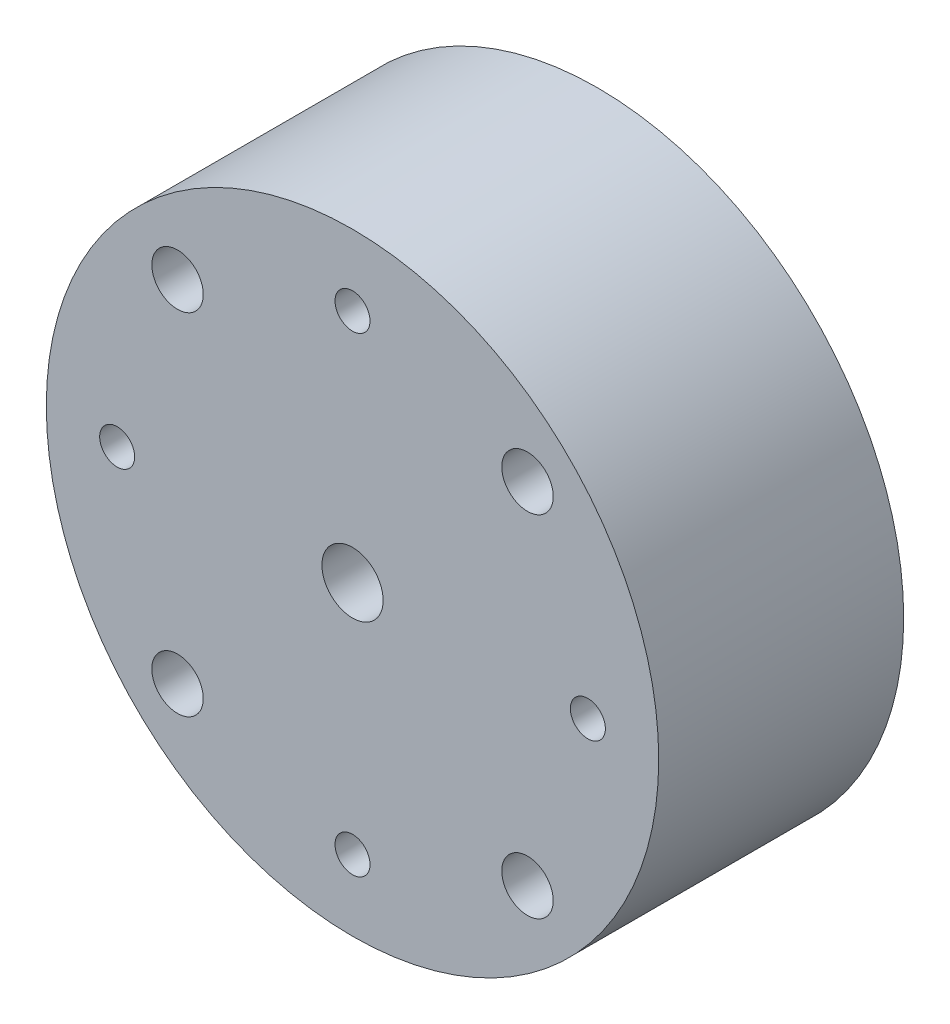
from build123d import *

# Parameters (mm, degrees)
SKETCH1_R           = 17.5
SKETCH1_R_2         = 1.75
BOSS_EXTRUDE1_DEPTH = 14
SKETCH2_R           = 1
CUT_EXTRUDE1_DEPTH  = 29.434134416
CIRPATTERN1_COUNT   = 4
SKETCH3_R           = 1.47
CUT_EXTRUDE2_DEPTH  = 29.434134416
CIRPATTERN2_COUNT   = 4


with BuildPart() as part:
    # Sketch1 → Boss-Extrude1 (new body)
    with BuildSketch(Plane.XY):
        Circle(SKETCH1_R)
        Circle(SKETCH1_R_2, mode=Mode.SUBTRACT)
    extrude(amount=BOSS_EXTRUDE1_DEPTH)

    # Sketch2 → Cut-Extrude1 (cut, through all)
    with BuildSketch(Plane.XY.offset(14)):
        with Locations((0, 13.45)):
            Circle(SKETCH2_R)
    cut_extrude1 = extrude(amount=-CUT_EXTRUDE1_DEPTH, mode=Mode.SUBTRACT)

    # CirPattern1: Cut-Extrude1 ×4 about axis
    cirpattern1_axis = Axis((0, 0, 0), (0, 0, 1))
    for i in range(1, CIRPATTERN1_COUNT):
        add(cut_extrude1.rotate(cirpattern1_axis, i * 360 / CIRPATTERN1_COUNT), mode=Mode.SUBTRACT)

    # Sketch3 → Cut-Extrude2 (cut, through all)
    with BuildSketch(Plane.XY.offset(14)):
        with Locations((-10, -10)):
            Circle(SKETCH3_R)
    cut_extrude2 = extrude(amount=-CUT_EXTRUDE2_DEPTH, mode=Mode.SUBTRACT)

    # CirPattern2: Cut-Extrude2 ×4 about axis
    cirpattern2_axis = Axis((0, 0, 0), (0, 0, 1))
    for i in range(1, CIRPATTERN2_COUNT):
        add(cut_extrude2.rotate(cirpattern2_axis, i * 360 / CIRPATTERN2_COUNT), mode=Mode.SUBTRACT)


solid = part.part
